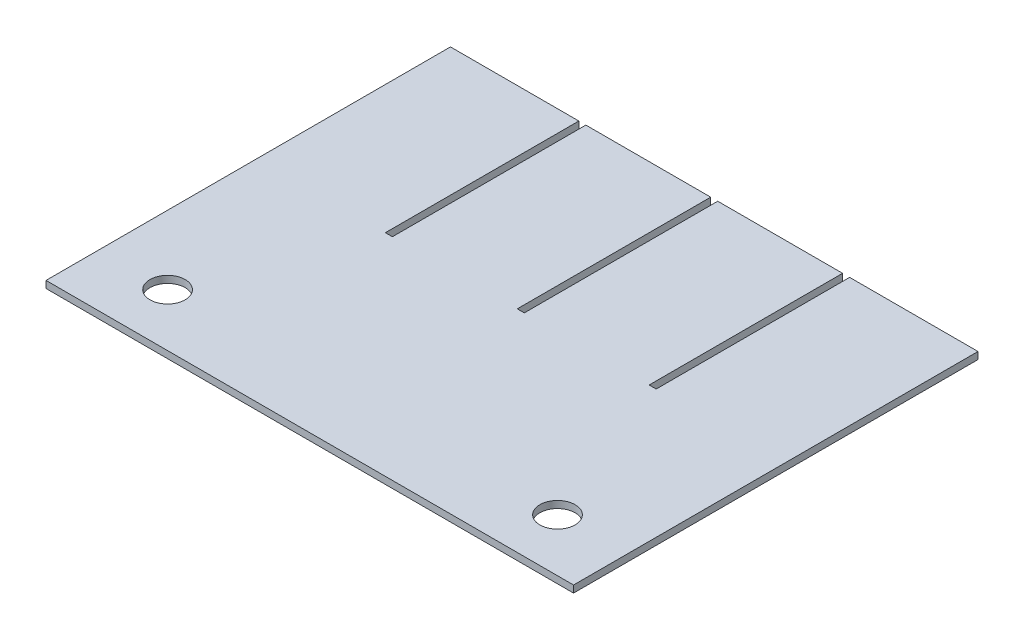
from build123d import *

# Parameters (mm, degrees)
SKETCH1_R           = 5
BOSS_EXTRUDE1_DEPTH = 2


with BuildPart() as part:
    # Sketch1 → Boss-Extrude1 (new body)
    with BuildSketch(Plane(origin=(0, 0, 0), x_dir=(1, 0, 0), z_dir=(0, 1, 0))):
        Polygon((1, 57.5), (36.5, 57.5), (36.5, 2.5), (38.5, 2.5), (38.5, 57.5), (75, 57.5), (75, -57.5), (-75, -57.5), (-75, 57.5), (-38.5, 57.5), (-38.5, 2.5), (-36.5, 2.5), (-36.5, 57.5), (-1, 57.5), (-1, 2.5), (1, 2.5), align=None)
        with Locations(Location((-55.434782609, -42.5, 0), (0, 0, 270))):
            Circle(SKETCH1_R, mode=Mode.SUBTRACT)
        with Locations(Location((55.434782609, -42.5, 0), (0, 0, 270))):
            Circle(SKETCH1_R, mode=Mode.SUBTRACT)
    extrude(amount=BOSS_EXTRUDE1_DEPTH)


solid = part.part
